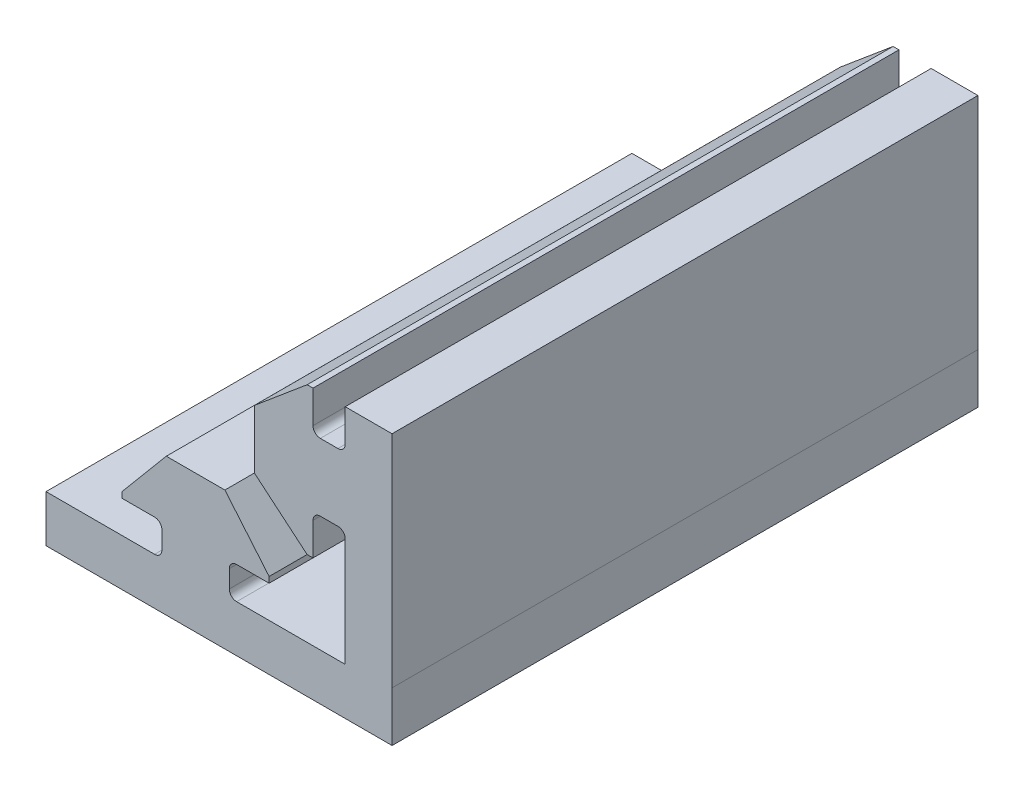
from build123d import *

# Parameters (mm, degrees)
BOSS_EXTRUDE1_DEPTH = 50.8


with BuildPart() as part:
    # Sketch1 → Boss-Extrude1 (new body)
    with BuildSketch(Plane(origin=(0, 0, -3683), x_dir=(-1, 0, 0), z_dir=(0, 0, -1))):
        with BuildLine():
            Line((7.945265893, 3.588862728), (-1.198734107, 3.588862728))
            ThreePointArc((-1.198734107, 3.588862728), (-1.647746913, 3.774849922), (-1.833734107, 4.223862728))
            Line((-1.833734107, 4.223862728), (-1.833734107, 5.747862728))
            ThreePointArc((-1.833734107, 5.747862728), (-1.647746913, 6.196875535), (-1.198734107, 6.382862728))
            Line((-1.198734107, 6.382862728), (1.621629442, 6.382862728))
            Line((1.621629442, 6.382862728), (1.621629442, 6.890862686))
            Line((1.621629442, 6.890862686), (-2.214734107, 11.462862728))
            Line((-2.214734107, 11.462862728), (-7.294734107, 11.462862728))
            Line((-7.294734107, 11.462862728), (-11.131097656, 6.890862686))
            Line((-11.131097656, 6.890862686), (-11.131097656, 6.382862728))
            Line((-11.131097656, 6.382862728), (-8.310734107, 6.382862728))
            ThreePointArc((-8.310734107, 6.382862728), (-7.861721301, 6.196875535), (-7.675734107, 5.747862728))
            Line((-7.675734107, 5.747862728), (-7.675734107, 4.223862728))
            ThreePointArc((-7.675734107, 4.223862728), (-7.861721301, 3.774849922), (-8.310734107, 3.588862728))
            Line((-8.310734107, 3.588862728), (-17.454734107, 3.588862728))
            Line((-17.454734107, 3.588862728), (-17.727921752, 3.588862728))
            Line((-17.727921752, 3.588862728), (-17.727921752, 3.858842754))
            Line((-17.727921752, 3.858842754), (-17.728361466, 13.002372481))
            ThreePointArc((-17.728361466, 13.002372481), (-17.542256287, 13.451715967), (-17.092921752, 13.637842754))
            Line((-17.092921752, 13.637842754), (-15.568921752, 13.637842754))
            ThreePointArc((-15.568921752, 13.637842754), (-15.119908946, 13.45185556), (-14.933921752, 13.002842754))
            Line((-14.933921752, 13.002842754), (-14.933921752, 10.182479205))
            Line((-14.933921752, 10.182479205), (-14.425921794, 10.182479205))
            Line((-14.425921794, 10.182479205), (-9.853921752, 14.018842754))
            Line((-9.853921752, 14.018842754), (-9.853921752, 19.098842754))
            Line((-9.853921752, 19.098842754), (-14.425921794, 22.935206303))
            Line((-14.425921794, 22.935206303), (-14.933921752, 22.935206303))
            Line((-14.933921752, 22.935206303), (-14.933921752, 20.114842754))
            ThreePointArc((-14.933921752, 20.114842754), (-15.119908946, 19.665829948), (-15.568921752, 19.479842754))
            Line((-15.568921752, 19.479842754), (-17.092921752, 19.479842754))
            ThreePointArc((-17.092921752, 19.479842754), (-17.542476558, 19.66604812), (-17.728703542, 20.11559397))
            Line((-17.728703542, 20.11559397), (-17.728839138, 22.935206303))
            Line((-17.728839138, 22.935206303), (-21.787214199, 22.935206303))
            Line((-21.787214199, 22.935206303), (-21.791921752, 3.859128788))
            Line((-21.791921752, 3.859128788), (-21.791921752, 3.588862728))
            Line((-21.791921752, 3.588862728), (-21.791921752, -0.475137272))
            Line((-21.791921752, -0.475137272), (-17.727921752, -0.475137272))
            Line((-17.727921752, -0.475137272), (-17.454774021, -0.475137272))
            Line((-17.454774021, -0.475137272), (7.945225979, -0.475137272))
            Line((7.945225979, -0.475137272), (8.215492039, -0.475137272))
            Line((8.215492039, -0.475137272), (8.215492039, 3.588862728))
            Line((8.215492039, 3.588862728), (7.945265893, 3.588862728))
        make_face()
    extrude(amount=BOSS_EXTRUDE1_DEPTH)


solid = part.part
